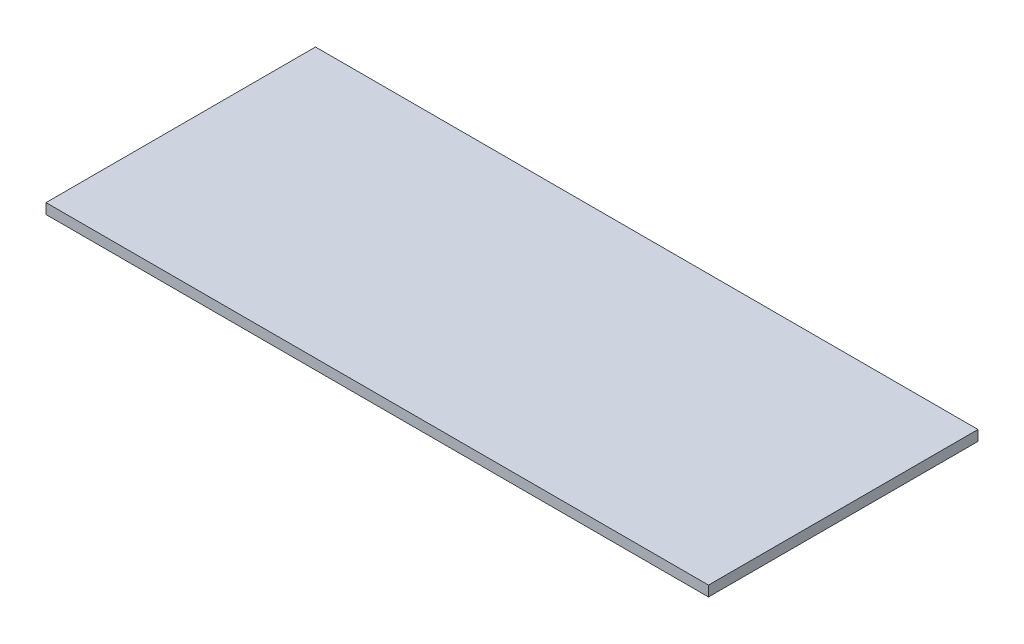
from build123d import *

# Parameters (mm, degrees)
SKETCH1_W           = 304.8
SKETCH1_H           = 124
BOSS_EXTRUDE2_DEPTH = 4.7625


with BuildPart() as part:
    # Sketch1 → Boss-Extrude2 (new body)
    with BuildSketch(Plane(origin=(0, 0, 0), x_dir=(1, 0, 0), z_dir=(0, 1, 0))):
        with Locations((93.271051813, 33.599481579)):
            Rectangle(SKETCH1_W, SKETCH1_H)
    extrude(amount=BOSS_EXTRUDE2_DEPTH)


solid = part.part
